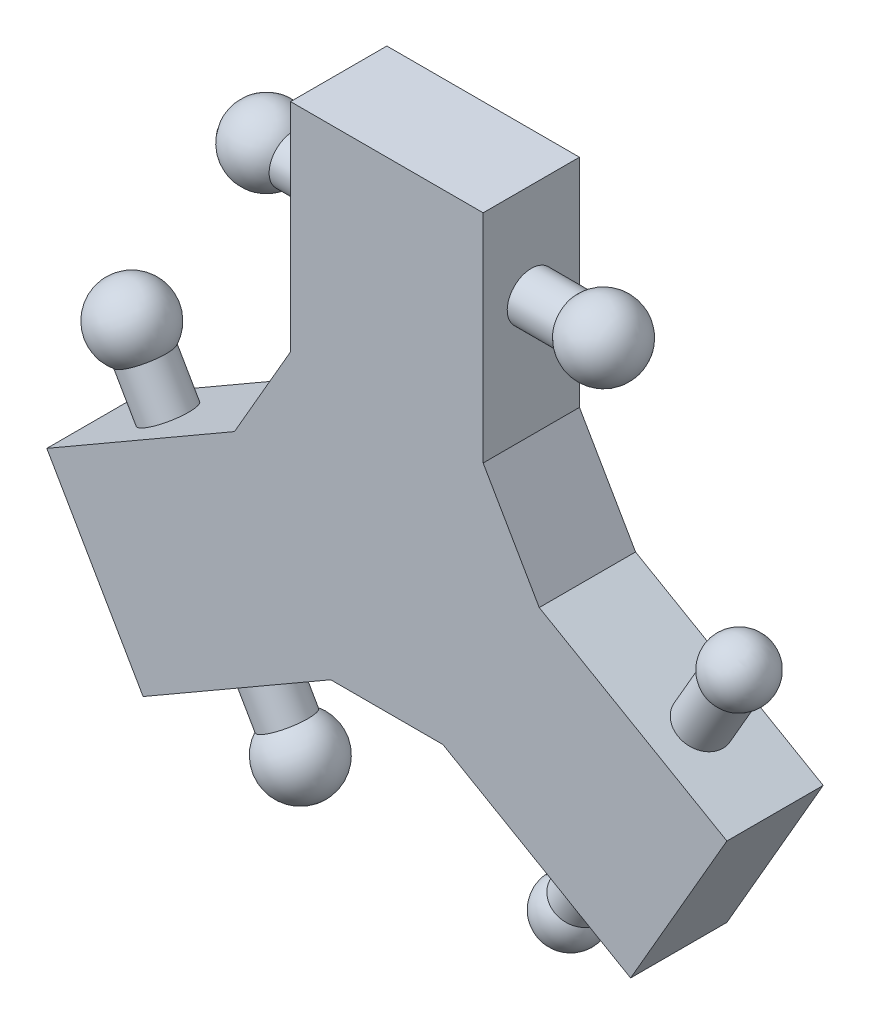
from build123d import *

# Parameters (mm, degrees)
BOSS_EXTRUDE1_DEPTH = 4
SKETCH4_R           = 1
BOSS_EXTRUDE2_DEPTH = 3
CIRPATTERN1_COUNT   = 3
BOSS_EXTRUDE3_START = 3
SKETCH8_R           = 1
BOSS_EXTRUDE3_DEPTH = 3
BOSS_EXTRUDE4_START = 3
SKETCH11_R          = 1
BOSS_EXTRUDE4_DEPTH = 3
SKETCH16_R          = 1
BOSS_EXTRUDE6_DEPTH = 3
SKETCH23_R          = 1
BOSS_EXTRUDE8_DEPTH = 3
BOSS_EXTRUDE9_START = 3
SKETCH21_R          = 1
BOSS_EXTRUDE9_DEPTH = 3


with BuildPart() as part:
    # Sketch1 → Boss-Extrude1 (new body)
    with BuildSketch(Plane.XY):
        Polygon((-4, 20), (4, 20), (4, 11), (6.330127019, 6.964101615), (14.124355653, 2.464101615), (10.124355653, -4.464101615), (2.330127019, 0.035898385), (-2.330127019, 0.035898385), (-10.124355653, -4.464101615), (-14.124355653, 2.464101615), (-6.330127019, 6.964101615), (-4, 11), align=None)
    extrude(amount=BOSS_EXTRUDE1_DEPTH)

    # Sketch4 → Boss-Extrude2 (add)
    with BuildSketch(Plane(origin=(-0.598076211, 1.035898385, 0), x_dir=(0.8660254037844431, 0.49999999999999223, 0), z_dir=(0.49999999999999223, -0.8660254037844431, 0))):
        with Locations(Location((-7.5, 2, 0), (0, 0, 180))):
            Circle(SKETCH4_R)
    boss_extrude2 = extrude(amount=BOSS_EXTRUDE2_DEPTH)

    # CirPattern1: Boss-Extrude2 ×3 about axis
    cirpattern1_axis = Axis((0, 0, 0), (0, 0, 1))
    for i in range(1, CIRPATTERN1_COUNT):
        add(boss_extrude2.rotate(cirpattern1_axis, i * 360 / CIRPATTERN1_COUNT))

    # Sketch6 → Revolve1 (revolve)
    with BuildSketch(Plane(origin=(3.5, 6.062177826, 0), x_dir=(0.8660254037844365, -0.5000000000000039, 0), z_dir=(0.5000000000000038, 0.8660254037844364, 0))):
        with BuildLine():
            Line((7.486880827, -0.679237196), (7.486880827, -3.224244757))
            ThreePointArc((7.486880827, -3.224244757), (8.759384608, -1.951740977), (7.486880827, -0.679237196))
        make_face()
    revolve(axis=Axis((9.983828992, 2.318737413, 1001.951740977), (0, 0, -1)))

    # Sketch8 → Boss-Extrude3 (add)
    with BuildSketch(Plane(origin=(0.598076211, 1.035898385, 0), x_dir=(0.8660254037844365, -0.5000000000000039, 0), z_dir=(-0.5000000000000039, -0.8660254037844365, 0)).offset(BOSS_EXTRUDE3_START)):
        with Locations((7.5, 2)):
            Circle(SKETCH8_R)
    extrude(amount=-BOSS_EXTRUDE3_DEPTH)

    # Sketch9 → Revolve2 (revolve)
    with BuildSketch(Plane(origin=(-0.901923789, -1.562177826, 0), x_dir=(0.8660254037844364, -0.500000000000004, 0), z_dir=(-0.500000000000004, -0.8660254037844365, 0))):
        with BuildLine():
            Line((7.486880827, 3.224244757), (7.486880827, 0.679237196))
            ThreePointArc((7.486880827, 0.679237196), (8.759384608, 1.951740977), (7.486880827, 3.224244757))
        make_face()
    revolve(axis=Axis((5.581905203, -5.30561824, -998.048259023), (0, 0, 1)))

    # Sketch10 → Revolve3 (revolve)
    with BuildSketch(Plane(origin=(0.901923789, -1.562177826, 0), x_dir=(0.8660254037844431, 0.4999999999999923, 0), z_dir=(0.49999999999999223, -0.866025403784443, 0))):
        with BuildLine():
            Line((-7.5, 3.5), (-7.5, 0.5))
            ThreePointArc((-7.5, 0.5), (-6, 2), (-7.5, 3.5))
        make_face()
    revolve(axis=Axis((-5.59326674, -5.312177826, -998), (0, 0, 1)))

    # Sketch11 → Boss-Extrude4 (add)
    with BuildSketch(Plane(origin=(-4.598076211, 7.964101615, 0), x_dir=(0.8660254037844433, 0.49999999999999195, 0), z_dir=(-0.49999999999999195, 0.8660254037844433, 0)).offset(BOSS_EXTRUDE4_START)):
        with Locations(Location((-7.5, -2, 0), (0, 0, 180))):
            Circle(SKETCH11_R)
    extrude(amount=-BOSS_EXTRUDE4_DEPTH)

    # Sketch12 → Revolve4 (revolve)
    with BuildSketch(Plane(origin=(-6.098076211, 10.562177826, 0), x_dir=(0.8660254037844434, 0.49999999999999195, 0), z_dir=(-0.49999999999999195, 0.8660254037844434, 0))):
        with BuildLine():
            Line((-7.5, -0.5), (-7.5, -3.5))
            ThreePointArc((-7.5, -3.5), (-6, -2), (-7.5, -0.5))
        make_face()
    revolve(axis=Axis((-12.59326674, 6.812177826, 1002), (0, 0, -1)))

    # Sketch16 → Boss-Extrude6 (add)
    with BuildSketch(Plane(origin=(4.598076211, 7.964101615, 0), x_dir=(0.8660254037844386, -0.5000000000000001, 0), z_dir=(0.5000000000000001, 0.8660254037844386, 0))):
        with Locations(Location((7.5, -2, 0), (0, 0, 141.776738897))):
            Circle(SKETCH16_R)
    extrude(amount=BOSS_EXTRUDE6_DEPTH)

    # Sketch17 → Revolve7 (revolve)
    with BuildSketch(Plane(origin=(6.098076211, 10.562177826, 0), x_dir=(0.8660254037844386, -0.5000000000000001, 0), z_dir=(0.5000000000000001, 0.8660254037844386, 0))):
        with BuildLine():
            Line((7.486880827, -0.679237196), (7.486880827, -3.224244757))
            ThreePointArc((7.486880827, -3.224244757), (8.759384608, -1.951740977), (7.486880827, -0.679237196))
        make_face()
    revolve(axis=Axis((12.581905203, 6.818737413, 1001.951740977), (0, 0, -1)))

    # Sketch23 → Boss-Extrude8 (add)
    with BuildSketch(Plane(origin=(4, 0, 0), x_dir=(0, 0, -1), z_dir=(1, 0, 0))):
        with Locations(Location((-2, 16, 0), (0, 0, 270))):
            Circle(SKETCH23_R)
    extrude(amount=BOSS_EXTRUDE8_DEPTH)

    # Sketch25 → Revolve9 (revolve)
    with BuildSketch(Plane(origin=(7, 0, 0), x_dir=(0, 0, -1), z_dir=(1, 0, 0))):
        with BuildLine():
            Line((-2, 17.5), (-2, 14.5))
            ThreePointArc((-2, 14.5), (-0.5, 16), (-2, 17.5))
        make_face()
    revolve(axis=Axis((7, -984, 2), (0, 1, 0)))

    # Sketch21 → Boss-Extrude9 (add)
    with BuildSketch(Plane.ZY.offset(4).offset(BOSS_EXTRUDE9_START)):
        with Locations(Location((2, 16, 0), (0, 0, 270))):
            Circle(SKETCH21_R)
    extrude(amount=-BOSS_EXTRUDE9_DEPTH)

    # Sketch26 → Revolve10 (revolve)
    with BuildSketch(Plane.ZY.offset(7)):
        with BuildLine():
            Line((2, 17.506711092), (2, 14.518258878))
            ThreePointArc((2, 14.518258878), (3.494226107, 16.012484985), (2, 17.506711092))
        make_face()
    revolve(axis=Axis((-7, -984, 2), (0, 1, 0)))


solid = part.part
